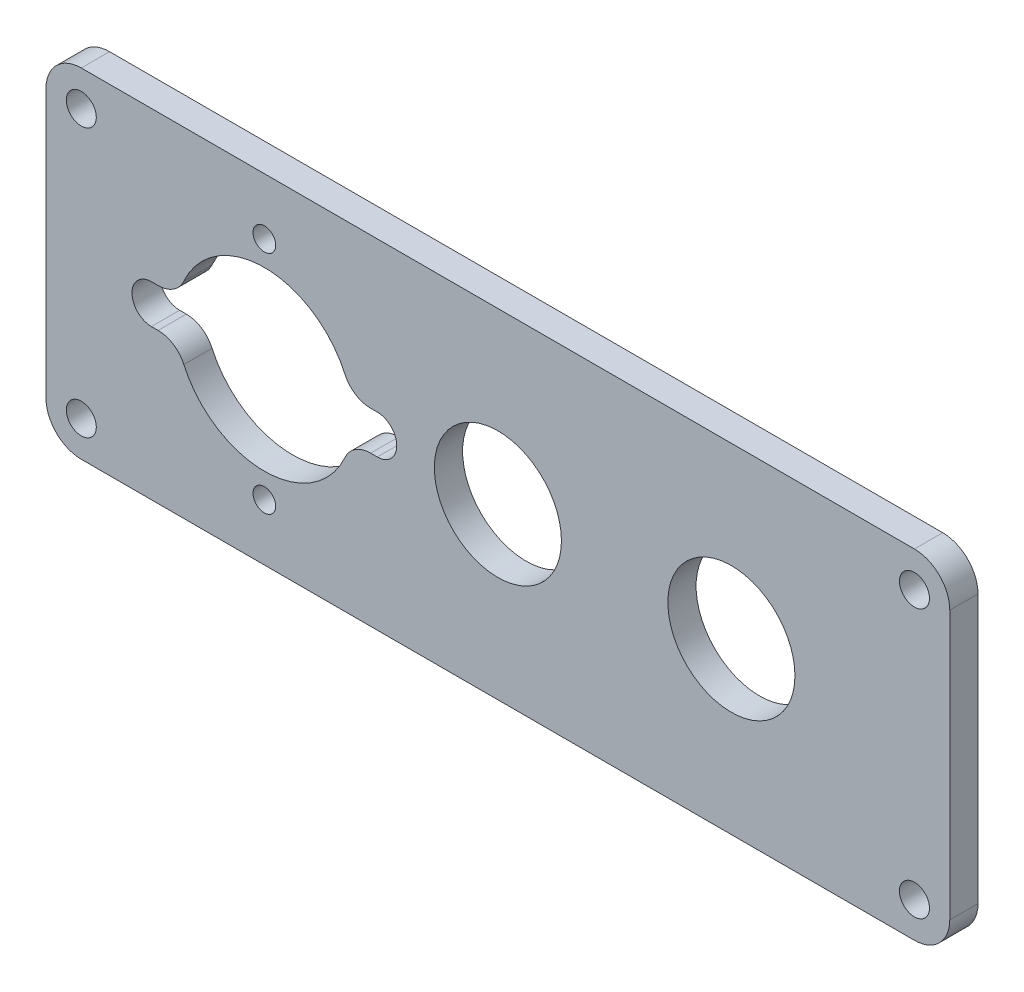
from build123d import *

# Parameters (mm, degrees)
SKETCH1_R           = 14.2875
SKETCH1_R_2         = 3.3734375
SKETCH1_R_3         = 2.5527
BOSS_EXTRUDE1_DEPTH = 6.35


with BuildPart() as part:
    # Sketch1 → Boss-Extrude1 (new body)
    with BuildSketch(Plane.XY):
        with BuildLine():
            Line((-93.6625, -38.1), (93.6625, -38.1))
            ThreePointArc((93.6625, -38.1), (99.275160076, -35.775160076), (101.6, -30.1625))
            Line((101.6, -30.1625), (101.6, 30.1625))
            ThreePointArc((101.6, 30.1625), (99.275160076, 35.775160076), (93.6625, 38.1))
            Line((93.6625, 38.1), (-93.6625, 38.1))
            ThreePointArc((-93.6625, 38.1), (-99.275160076, 35.775160076), (-101.6, 30.1625))
            Line((-101.6, 30.1625), (-101.6, -30.1625))
            ThreePointArc((-101.6, -30.1625), (-99.275160076, -35.775160076), (-93.6625, -38.1))
        make_face()
        Circle(SKETCH1_R, mode=Mode.SUBTRACT)
        with Locations((52.5018, 0)):
            Circle(SKETCH1_R, mode=Mode.SUBTRACT)
        with Locations((-93.6625, 30.1625)):
            Circle(SKETCH1_R_2, mode=Mode.SUBTRACT)
        with Locations((93.6625, 30.1625)):
            Circle(SKETCH1_R_2, mode=Mode.SUBTRACT)
        with Locations((93.6625, -30.1625)):
            Circle(SKETCH1_R_2, mode=Mode.SUBTRACT)
        with Locations((-93.6625, -30.1625)):
            Circle(SKETCH1_R_2, mode=Mode.SUBTRACT)
        with Locations((-52.5018, 25.4)):
            Circle(SKETCH1_R_3, mode=Mode.SUBTRACT)
        with Locations((-52.5018, -25.4)):
            Circle(SKETCH1_R_3, mode=Mode.SUBTRACT)
        with BuildLine():
            Line((-28.601593607, 4.3688), (-27.1018, 4.3688))
            ThreePointArc((-27.1018, 4.3688), (-22.733, 0), (-27.1018, -4.3688))
            Line((-27.1018, -4.3688), (-28.601593607, -4.3688))
            ThreePointArc((-28.601593607, -4.3688), (-32.052828476, -5.388558178), (-34.395583036, -8.12030303))
            ThreePointArc((-34.395583036, -8.12030303), (-52.5018, -19.84375), (-70.608016964, -8.12030303))
            ThreePointArc((-70.608016964, -8.12030303), (-72.950771524, -5.388558178), (-76.402006393, -4.3688))
            Line((-76.402006393, -4.3688), (-77.9018, -4.3688))
            ThreePointArc((-77.9018, -4.3688), (-82.2706, 0), (-77.9018, 4.3688))
            Line((-77.9018, 4.3688), (-76.402006393, 4.3688))
            ThreePointArc((-76.402006393, 4.3688), (-72.950771524, 5.388558178), (-70.608016964, 8.12030303))
            ThreePointArc((-70.608016964, 8.12030303), (-52.5018, 19.84375), (-34.395583036, 8.12030303))
            ThreePointArc((-34.395583036, 8.12030303), (-32.052828476, 5.388558178), (-28.601593607, 4.3688))
        make_face(mode=Mode.SUBTRACT)
    extrude(amount=BOSS_EXTRUDE1_DEPTH)


solid = part.part
